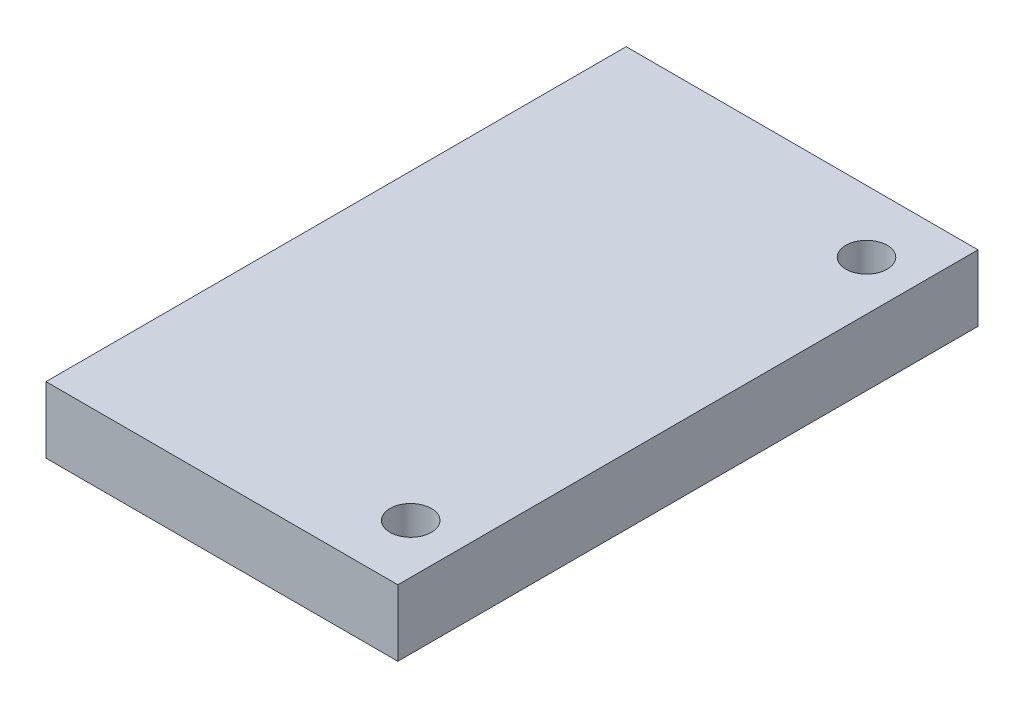
from build123d import *

# Parameters (mm, degrees)
SKETCH_1_W      = 8.490503901
SKETCH_1_H      = 14
SKETCH_1_R      = 0.5
EXTRUDE_1_DEPTH = 1.6


with BuildPart() as part:
    # Эскиз1 → Бобышка-Вытянуть1 (new body)
    with BuildSketch(Plane(origin=(0, 0, 0), x_dir=(1, 0, 0), z_dir=(0, 1, 0))):
        with Locations((-4.254748049, 0)):
            Rectangle(SKETCH_1_W, SKETCH_1_H)
        with Locations(Location((-1.2, 5.5, 0), (0, 0, 270))):
            Circle(SKETCH_1_R, mode=Mode.SUBTRACT)
        with Locations(Location((-1.2, -5.5, 0), (0, 0, 270))):
            Circle(SKETCH_1_R, mode=Mode.SUBTRACT)
    extrude(amount=EXTRUDE_1_DEPTH)


solid = part.part
